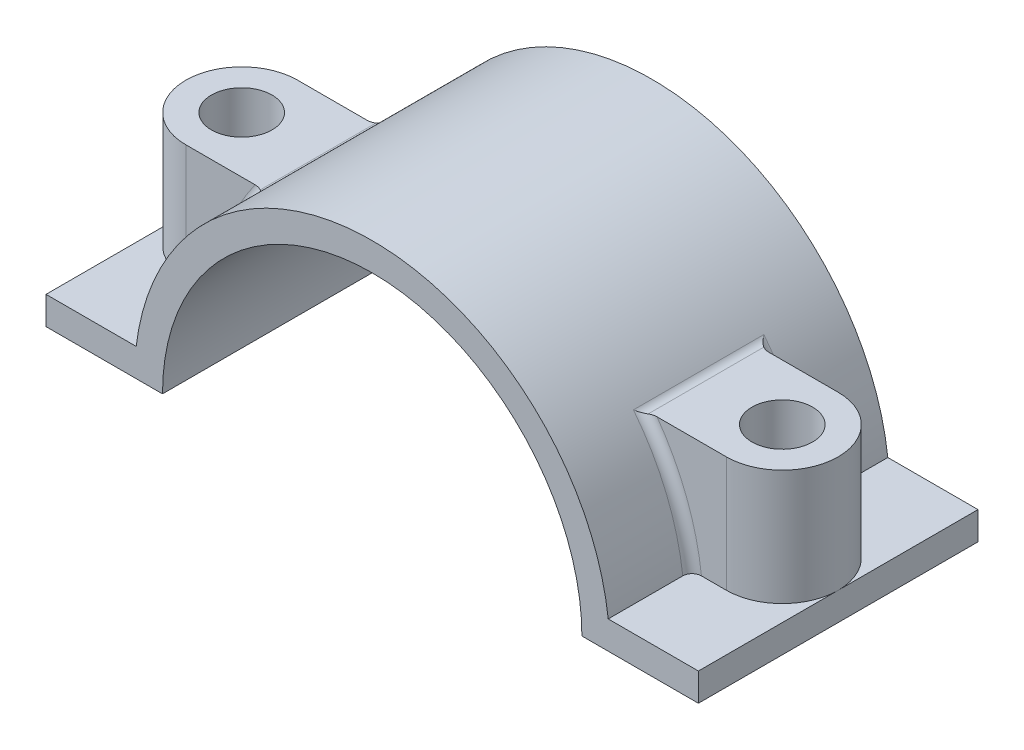
from build123d import *

# Parameters (mm, degrees)
BOSS_EXTRUDE1_DEPTH = 15
BOSS_EXTRUDE2_REACH = 43.075
SKETCH3_R           = 3.25
CUT_EXTRUDE1_DEPTH  = 42.075053256
FILLET1_R           = 1
FILLET2_R           = 1


with BuildPart() as part:
    # Sketch1 → Boss-Extrude1 (new, symmetric)
    with BuildSketch(Plane.XY):
        with BuildLine():
            Line((-22.5, 0), (-35, 0))
            Line((-35, 0), (-35, 3))
            Line((-35, 3), (-25.322914524, 3))
            ThreePointArc((-25.322914524, 3), (0, 25.5), (25.322914524, 3))
            Line((25.322914524, 3), (35, 3))
            Line((35, 3), (35, 0))
            Line((35, 0), (22.5, 0))
            ThreePointArc((22.5, 0), (0, 22.5), (-22.5, 0))
        make_face()
    extrude(amount=BOSS_EXTRUDE1_DEPTH, both=True)

    # Sketch2 → Boss-Extrude2 (add, up to next)
    with BuildSketch(Plane(origin=(0, 15.4, 0), x_dir=(1, 0, 0), z_dir=(0, 1, 0)), mode=Mode.PRIVATE) as boss_extrude2_sk1:
        with BuildLine():
            Line((-20.12, 6), (-20.12, -6))
            Line((-20.12, -6), (-29, -6))
            ThreePointArc((-29, -6), (-35, 0), (-29, 6))
            Line((-29, 6), (-20.12, 6))
        make_face()
    boss_extrude2_tool1 = extrude(boss_extrude2_sk1.sketch, amount=-BOSS_EXTRUDE2_REACH, mode=Mode.PRIVATE) - part.part
    boss_extrude2 = boss_extrude2_tool1.solids().sort_by_distance((-26.982165, 15.4, 0))[0]
    add(boss_extrude2)

    # Sketch3 → Cut-Extrude1 (cut, through all)
    with BuildSketch(Plane(origin=(0, 15.4, 0), x_dir=(1, 0, 0), z_dir=(0, 1, 0))):
        with Locations(Location((-29, 0, 0), (0, 0, 180))):
            Circle(SKETCH3_R)
    cut_extrude1 = extrude(amount=-CUT_EXTRUDE1_DEPTH, mode=Mode.SUBTRACT)

    # Mirror1: Boss-Extrude2, Cut-Extrude1 across plane
    add(boss_extrude2.mirror(Plane(origin=(0, 0, 0), x_dir=(0, 0, 1), z_dir=(1, 0, 0))))
    add(cut_extrude1.mirror(Plane(origin=(0, 0, 0), x_dir=(0, 0, 1), z_dir=(1, 0, 0))), mode=Mode.SUBTRACT)

    # Fillet1
    fillet1_edges = [part.edges().sort_by_distance(p)[0] for p in [
        (23.65088269, 9.533401701, -6),
        (23.65088269, 9.533401701, 6),
        (20.324615618, 15.4, 0),
    ]]
    fillet(fillet1_edges, radius=FILLET1_R)

    # Fillet2
    fillet2_edges = [part.edges().sort_by_distance(p)[0] for p in [
        (-23.65088269, 9.533401701, -6),
        (-23.65088269, 9.533401701, 6),
        (-20.324615618, 15.4, 0),
    ]]
    fillet(fillet2_edges, radius=FILLET2_R)


solid = part.part
